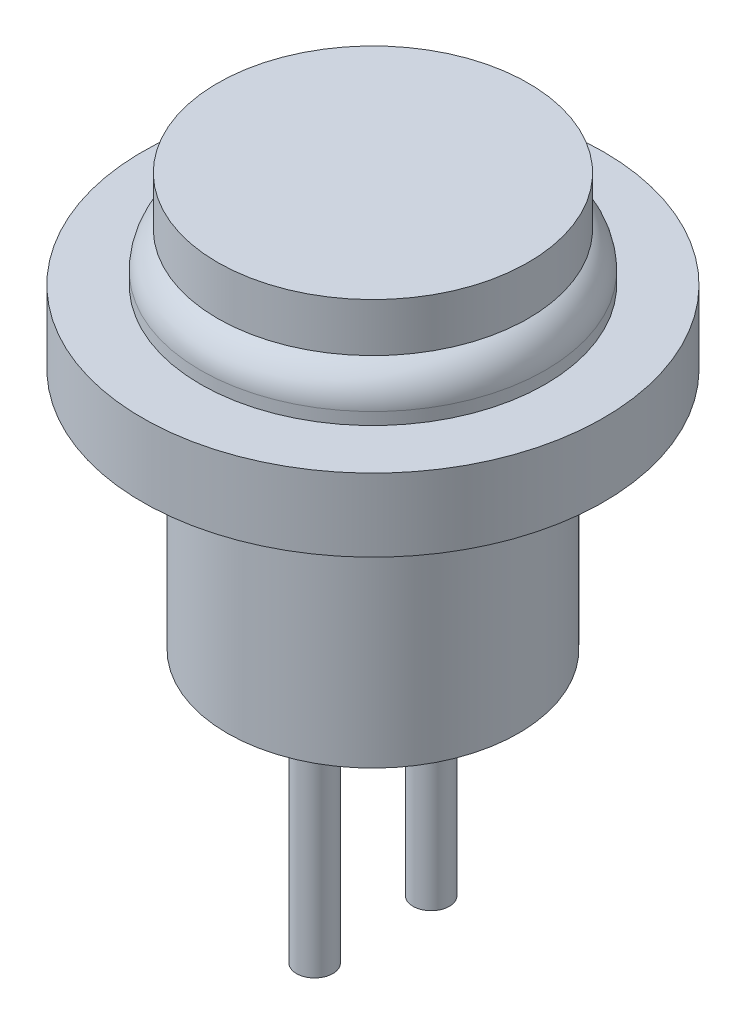
from build123d import *

# Parameters (mm, degrees)
SKETCH_1_R      = 7.1
EXTRUDE_1_DEPTH = 2
FILLET_1_R      = 1.5
SKETCH_2_R      = 6.4
EXTRUDE_2_DEPTH = 2
SKETCH_3_R      = 6
EXTRUDE_3_DEPTH = 13
SKETCH_4_R      = 0.75
EXTRUDE_4_DEPTH = 10
SKETCH_5_R      = 9.5
SKETCH_5_R_2    = 6
EXTRUDE_5_DEPTH = 3


with BuildPart() as part:
    # 草图1 → 拉伸1 (new body)
    with BuildSketch(Plane(origin=(0, 0, 0), x_dir=(1, 0, 0), z_dir=(0, 1, 0))):
        with Locations(Location((0, 0, 0), (0, 0, 270))):
            Circle(SKETCH_1_R)
    extrude(amount=EXTRUDE_1_DEPTH)

    # 圆角1
    fillet_1_edges = [part.edges().sort_by_distance(p)[0] for p in [
        (0, 2, -7.1),
    ]]
    fillet(fillet_1_edges, radius=FILLET_1_R)

    # 草图2 → 拉伸2 (add)
    with BuildSketch(Plane(origin=(0, 2, 0), x_dir=(-1, 0, 0), z_dir=(0, 1, 0))):
        with Locations(Location((0, 0, 0), (0, 0, 90))):
            Circle(SKETCH_2_R)
    extrude(amount=EXTRUDE_2_DEPTH)

    # 草图3 → 拉伸3 (add)
    with BuildSketch(Plane.XZ):
        with Locations(Location((0, 0, 0), (0, 0, 90))):
            Circle(SKETCH_3_R)
    extrude(amount=EXTRUDE_3_DEPTH)

    # 草图4 → 拉伸4 (add)
    with BuildSketch(Plane.XZ.offset(13)):
        with Locations(Location((0, -2.4, 0), (0, 0, 270))):
            Circle(SKETCH_4_R)
        with Locations(Location((0, 2.4, 0), (0, 0, 270))):
            Circle(SKETCH_4_R)
    extrude(amount=EXTRUDE_4_DEPTH)

    # 草图5 → 拉伸5 (add)
    with BuildSketch(Plane.XZ):
        with Locations(Location((0, 0, 0), (0, 0, 270))):
            Circle(SKETCH_5_R)
        with Locations(Location((0, 0, 0), (0, 0, 90))):
            Circle(SKETCH_5_R_2, mode=Mode.SUBTRACT)
    extrude(amount=EXTRUDE_5_DEPTH)


solid = part.part
